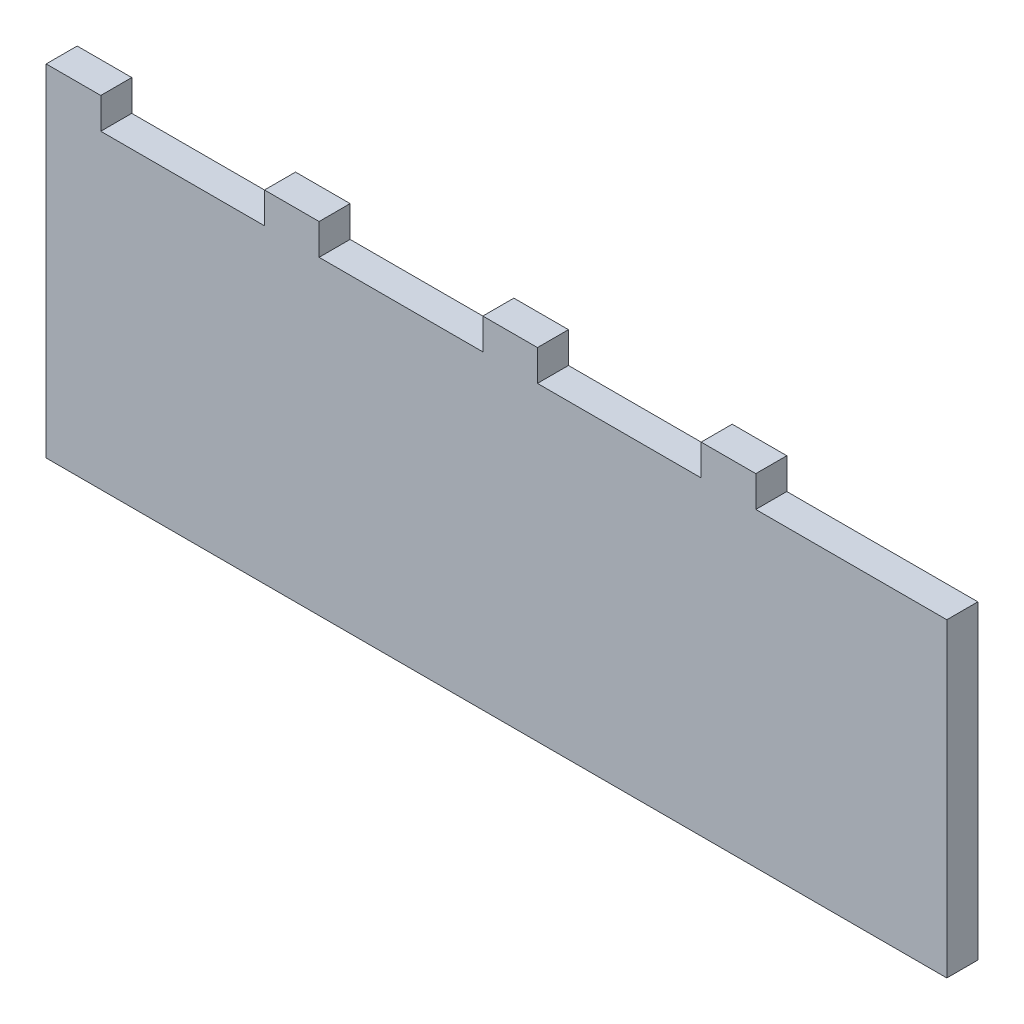
from build123d import *

# Parameters (mm, degrees)
BOSS_EXTRUDE1_DEPTH = 2.5


with BuildPart() as part:
    # Sketch1 → Boss-Extrude1 (new body)
    with BuildSketch(Plane.XY):
        Polygon((-2.2, 27.5), (-2.2, 0), (0, 0), (2.2, 0), (15.39291, 0), (19.79291, 0), (32.98582, 0), (37.38582, 0), (50.57873, 0), (54.97873, 0), (70.37167544, 0), (70.37167544, 25), (54.97873, 25), (54.97873, 27.5), (50.57873, 27.5), (50.57873, 25), (37.38582, 25), (37.38582, 27.5), (32.98582, 27.5), (32.98582, 25), (19.79291, 25), (19.79291, 27.5), (15.39291, 27.5), (15.39291, 25), (2.2, 25), (2.2, 27.5), align=None)
    extrude(amount=BOSS_EXTRUDE1_DEPTH)


solid = part.part
